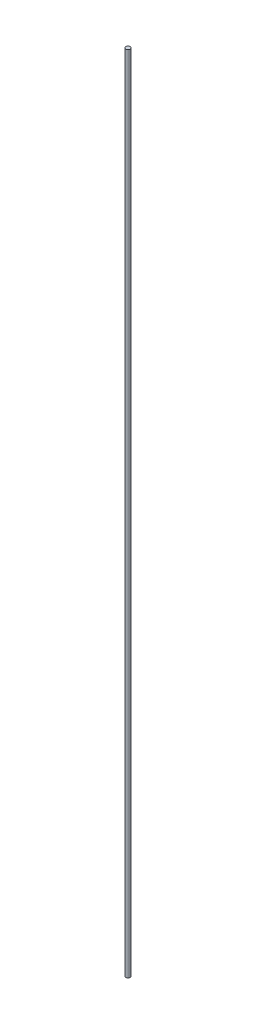
from build123d import *

# Parameters (mm, degrees)
SKETCH1_R           = 0.5
BOSS_EXTRUDE1_DEPTH = 180


with BuildPart() as part:
    # Sketch1 → Boss-Extrude1 (new body)
    with BuildSketch(Plane(origin=(0, 0, 0), x_dir=(1, 0, 0), z_dir=(0, 1, 0))):
        with Locations(Location((0, 0, 0), (0, 0, 270))):
            Circle(SKETCH1_R)
    extrude(amount=BOSS_EXTRUDE1_DEPTH)


solid = part.part
